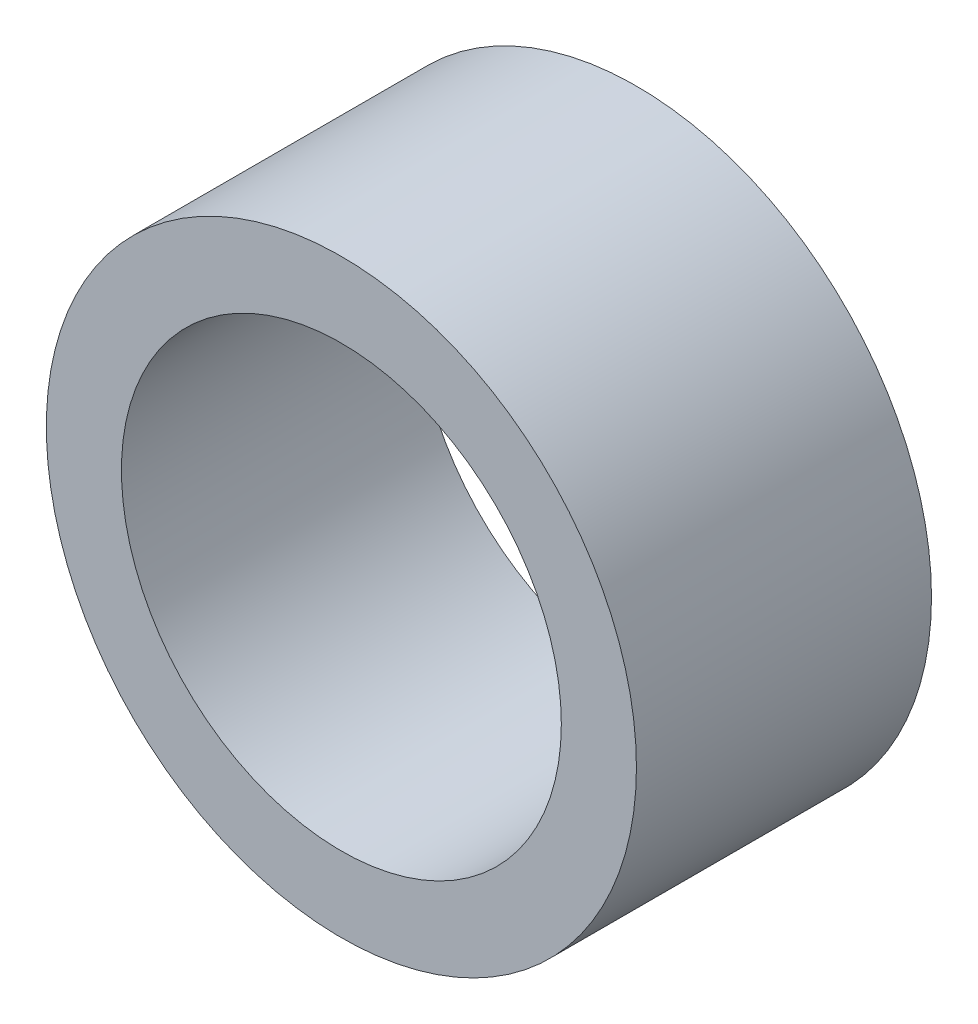
from build123d import *

# Parameters (mm, degrees)
SKETCH1_R           = 5.5
SKETCH1_R_2         = 4.1
BOSS_EXTRUDE1_DEPTH = 5.5


with BuildPart() as part:
    # Sketch1 → Boss-Extrude1 (new body)
    with BuildSketch(Plane.XY):
        Circle(SKETCH1_R)
        Circle(SKETCH1_R_2, mode=Mode.SUBTRACT)
    extrude(amount=BOSS_EXTRUDE1_DEPTH)


solid = part.part
